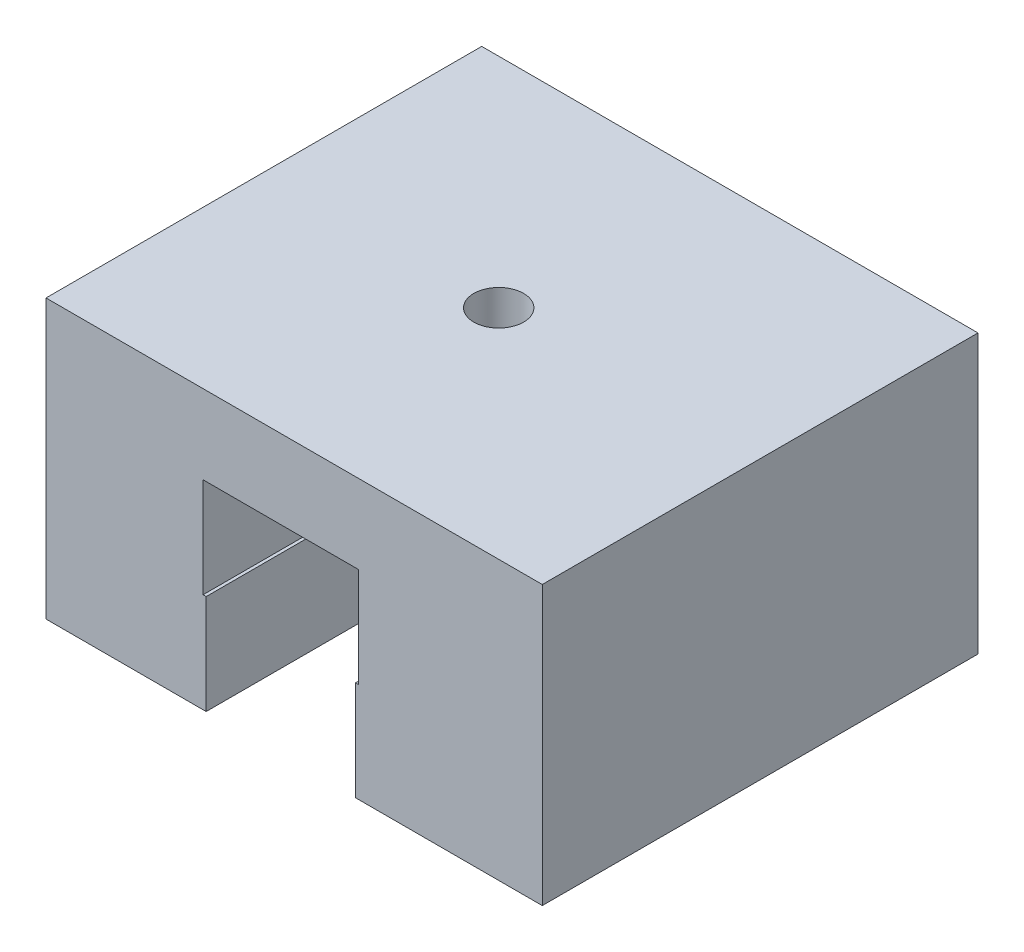
from build123d import *

# Parameters (mm, degrees)
SKETCH2_W           = 200
SKETCH2_H           = 35
BOSS_EXTRUDE1_DEPTH = 30
SKETCH3_R           = 6
CUT_EXTRUDE1_DEPTH  = 203.993226488
CUT_EXTRUDE2_DEPTH  = 22
SKETCH6_W           = 22.496439662
SKETCH6_H           = 14
BOSS_EXTRUDE3_DEPTH = 38
CUT_EXTRUDE4_DEPTH  = 17.5
SKETCH9_R           = 2
CUT_EXTRUDE5_DEPTH  = 38
SKETCH10_R          = 2.25
CUT_EXTRUDE6_DEPTH  = 20
SKETCH12_W          = 4.5
SKETCH12_H          = 7.5
CUT_EXTRUDE7_DEPTH  = 46
SKETCH14_W          = 405.367486884
SKETCH14_H          = 144.136743288
CUT_EXTRUDE9_DEPTH  = 206.243757518


with BuildPart() as part:
    # Sketch2 → Boss-Extrude1 (new body)
    with BuildSketch(Plane(origin=(0, 0, 0), x_dir=(1, 0, 0), z_dir=(0, 1, 0))):
        with Locations((-100, 0)):
            Rectangle(SKETCH2_W, SKETCH2_H)
    extrude(amount=BOSS_EXTRUDE1_DEPTH)

    # Sketch3 → Cut-Extrude1 (cut, through all)
    with BuildSketch(Plane.XZ):
        with Locations(Location((-21, 0, 0), (0, 0, 270))):
            Circle(SKETCH3_R)
    extrude(amount=-CUT_EXTRUDE1_DEPTH, mode=Mode.SUBTRACT)

    # Sketch4 → Cut-Extrude2 (cut)
    with BuildSketch(Plane(origin=(0, 30, 0), x_dir=(1, 0, 0), z_dir=(0, 1, 0))):
        Polygon((-14.75, 3.608439182), (-21, 7.216878365), (-27.25, 3.608439182), (-27.25, -3.608439182), (-21, -7.216878365), (-14.75, -3.608439182), align=None)
    extrude(amount=-CUT_EXTRUDE2_DEPTH, mode=Mode.SUBTRACT)

    # Sketch6 → Boss-Extrude3 (add)
    with BuildSketch(Plane(origin=(0, 0, 0), x_dir=(0, 0, -1), z_dir=(1, 0, 0))):
        with Locations((0.204742288, 23)):
            Rectangle(SKETCH6_W, SKETCH6_H)
    extrude(amount=-BOSS_EXTRUDE3_DEPTH)

    # Sketch7 → Cut-Extrude4 (cut)
    with BuildSketch(Plane.XY.offset(17.5)):
        Polygon((-21, 16), (-14.75, 16), (-14.75, 8), (-15, 8), (-15, 0), (-27, 0), (-27, 8), (-27.25, 8), (-27.25, 16), align=None)
    extrude(amount=-CUT_EXTRUDE4_DEPTH, mode=Mode.SUBTRACT)

    # Sketch9 → Cut-Extrude5 (cut)
    with BuildSketch(Plane(origin=(0, 30, 0), x_dir=(1, 0, 0), z_dir=(0, 1, 0))):
        with Locations(Location((-21, 0, 0), (0, 0, 270))):
            Circle(SKETCH9_R)
    extrude(amount=-CUT_EXTRUDE5_DEPTH, mode=Mode.SUBTRACT)

    # Sketch10 → Cut-Extrude6 (cut)
    with BuildSketch(Plane.ZY.offset(200)):
        with Locations((6.5, 21.5)):
            Circle(SKETCH10_R)
        with Locations((6.5, 8.5)):
            Circle(SKETCH10_R)
        with Locations((-6.5, 8.5)):
            Circle(SKETCH10_R)
        with Locations((-6.5, 21.5)):
            Circle(SKETCH10_R)
    extrude(amount=-CUT_EXTRUDE6_DEPTH, mode=Mode.SUBTRACT)

    # Sketch12 → Cut-Extrude7 (cut)
    with BuildSketch(Plane(origin=(0, 30, 0), x_dir=(1, 0, 0), z_dir=(0, 1, 0))):
        with Locations((-191.75, -6.5625)):
            Rectangle(SKETCH12_W, SKETCH12_H)
        with Locations((-191.75, 6.5625)):
            Rectangle(SKETCH12_W, SKETCH12_H)
    extrude(amount=-CUT_EXTRUDE7_DEPTH, mode=Mode.SUBTRACT)

    # Sketch14 → Cut-Extrude9 (cut, through all)
    # profile 1 of 2: a face of its own
    with BuildSketch(Plane.XY.offset(17.5)):
        with Locations((-15, 0)):
            Rectangle(SKETCH14_W, SKETCH14_H)
        Polygon((0, 30), (0, 22.340454029), (9.526767724, 22.340454029), (9.526767724, -15.531579882), (-39.86578, -15.531579882), (-39.86578, 0), (-200, 0), (-200, 30), align=None, mode=Mode.SUBTRACT)
    # profile 2 of 2: a face of its own
    with BuildSketch(Plane.XY.offset(17.5)):
        Polygon((-39.86578, 0), (-39.86578, 22.340454029), (0, 22.340454029), (0, 30), (-200, 30), (-200, 0), align=None)
    extrude(amount=-CUT_EXTRUDE9_DEPTH, mode=Mode.SUBTRACT)


solid = part.part
